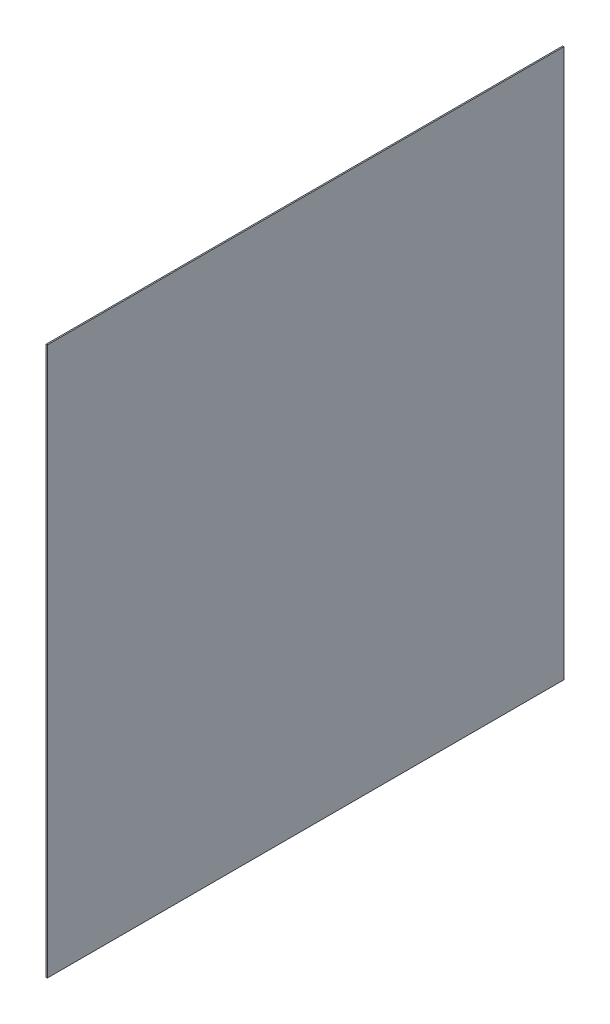
from build123d import *

# Parameters (mm, degrees)
SKETCH1_W           = 2116
SKETCH1_H           = 2247
BOSS_EXTRUDE1_DEPTH = 5


with BuildPart() as part:
    # Sketch1 → Boss-Extrude1 (new body)
    with BuildSketch(Plane(origin=(0, 0, 0), x_dir=(0, 0, -1), z_dir=(1, 0, 0))):
        Rectangle(SKETCH1_W, SKETCH1_H)
    extrude(amount=BOSS_EXTRUDE1_DEPTH)


solid = part.part
